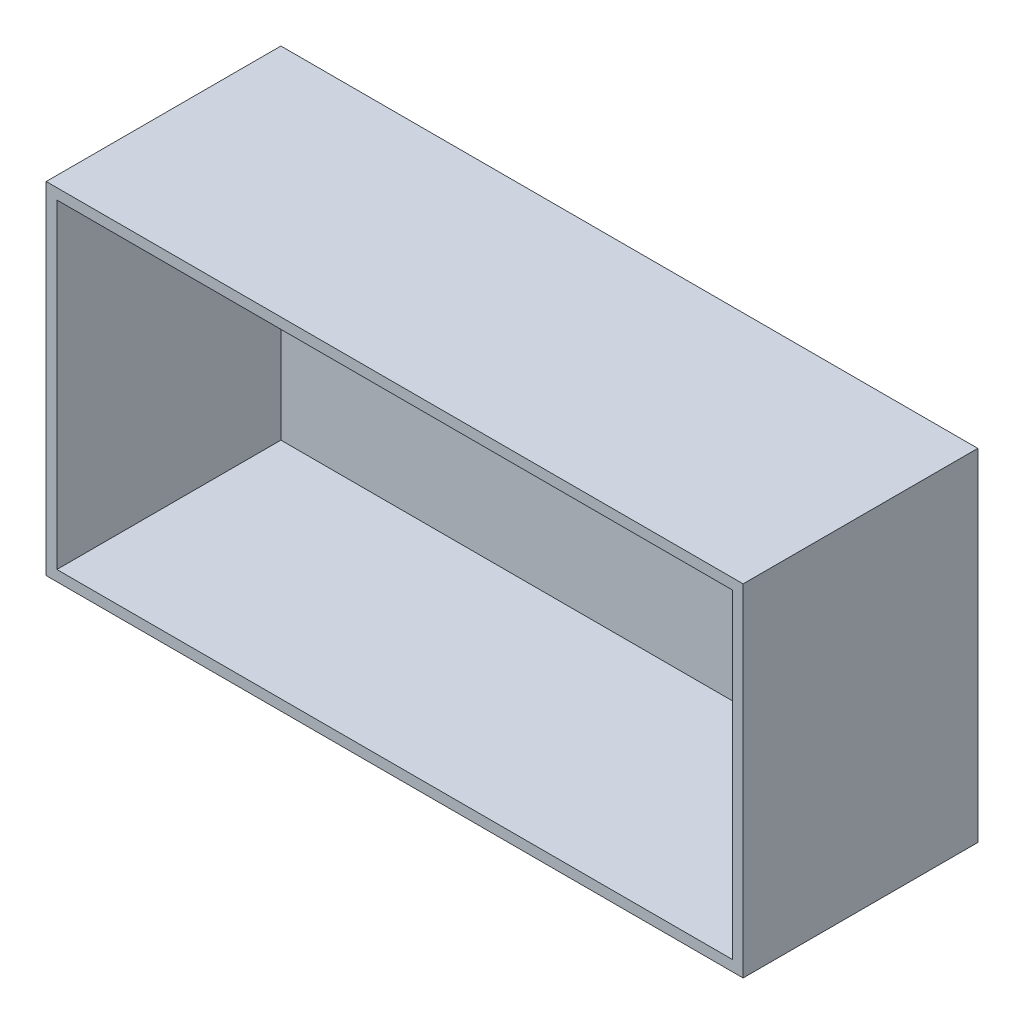
from build123d import *

# Parameters (mm, degrees)
SKETCH1_W     = 196
SKETCH1_H     = 96
SKETCH1_W_2   = 190
SKETCH1_H_2   = 90
PROFILE_DEPTH = 66
SKETCH2_W     = 190
SKETCH2_H     = 90
BACK_DEPTH    = 3


with BuildPart() as part:
    # Sketch1 → Profile (new body)
    with BuildSketch(Plane.XY):
        with Locations((98, 48)):
            Rectangle(SKETCH1_W, SKETCH1_H)
        with Locations((98, 48)):
            Rectangle(SKETCH1_W_2, SKETCH1_H_2, mode=Mode.SUBTRACT)
    extrude(amount=PROFILE_DEPTH)

    # Sketch2 → Back (add)
    with BuildSketch(Plane.XY):
        with Locations((98, 48)):
            Rectangle(SKETCH2_W, SKETCH2_H)
    extrude(amount=BACK_DEPTH)


solid = part.part
